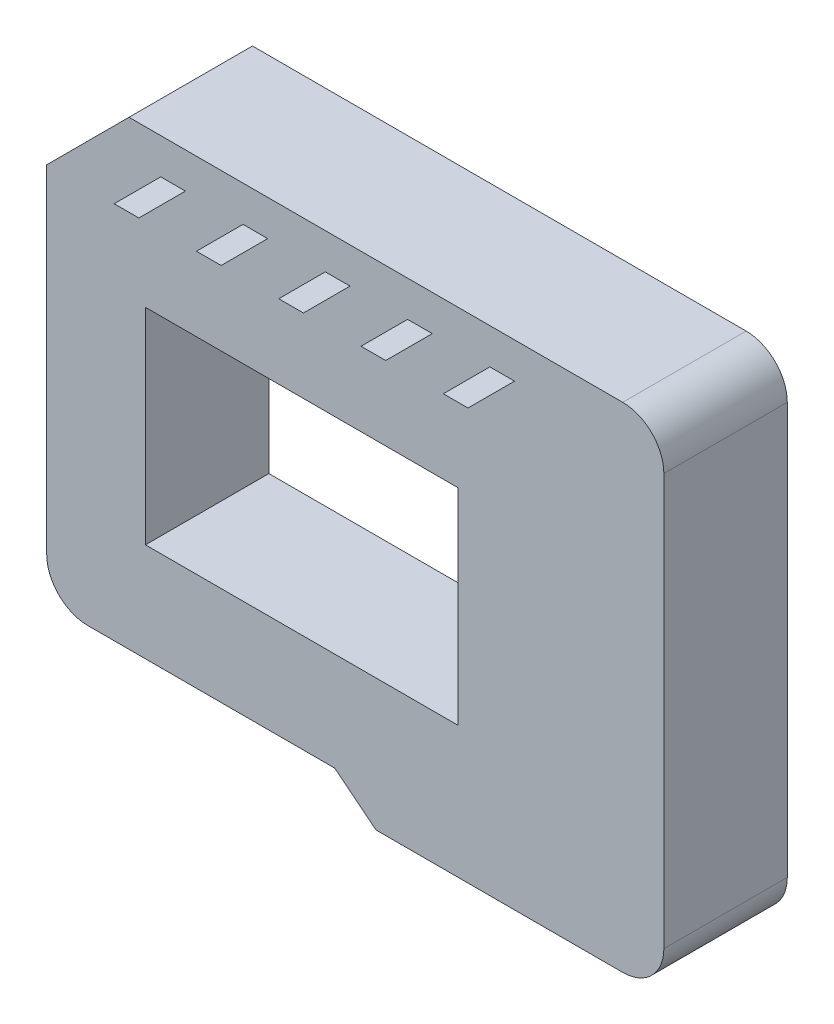
from build123d import *

# Parameters (mm, degrees)
EXTRUDE_1_DEPTH     = 15
FILLET_1_R          = 5
CUT_EXTRUDE_1_DEPTH = 90.724081338
SKETCH_4_W          = 38
SKETCH_4_H          = 25
CUT_EXTRUDE_2_DEPTH = 90.724081338


with BuildPart() as part:
    # 草图1 → 凸台-拉伸1 (new body)
    with BuildSketch(Plane.XY):
        Polygon((-9.999515105, -56.002897725), (25.000484895, -56.002897725), (30.000484895, -60.002897725), (65.000484895, -60.002897725), (65.000484895, -0.002897725), (0.000484895, -0.002897725), (-9.999515105, -10.002897725), align=None)
    extrude(amount=EXTRUDE_1_DEPTH)

    # 圆角1
    fillet_1_edges = [part.edges().sort_by_distance(p)[0] for p in [
        (-9.999515105, -56.002897725, 7.5),
        (65.000484895, -0.002897725, 7.5),
        (65.000484895, -60.002897725, 7.5),
    ]]
    fillet(fillet_1_edges, radius=FILLET_1_R)

    # 草图3 → 切除-拉伸1 (cut, through all)
    with BuildSketch(Plane.XY.offset(15)):
        Polygon((3.856343928, -4.346043475), (-1.800510321, -10.002897725), (1.199489679, -10.002897725), (6.856343928, -4.346043475), align=None)
        Polygon((16.856343928, -4.346043475), (11.199489679, -10.002897725), (8.199489679, -10.002897725), (13.856343928, -4.346043475), align=None)
        Polygon((26.856343928, -4.346043475), (21.199489679, -10.002897725), (18.199489679, -10.002897725), (23.856343928, -4.346043475), align=None)
        Polygon((36.856343928, -4.346043475), (31.199489679, -10.002897725), (28.199489679, -10.002897725), (33.856343928, -4.346043475), align=None)
        Polygon((46.856343928, -4.346043475), (41.199489679, -10.002897725), (38.199489679, -10.002897725), (43.856343928, -4.346043475), align=None)
    extrude(amount=-CUT_EXTRUDE_1_DEPTH, mode=Mode.SUBTRACT)

    # 草图4 → 切除-拉伸2 (cut, through all)
    with BuildSketch(Plane.XY.offset(15)):
        with Locations((21.000484895, -31.502897725)):
            Rectangle(SKETCH_4_W, SKETCH_4_H)
    extrude(amount=-CUT_EXTRUDE_2_DEPTH, mode=Mode.SUBTRACT)


solid = part.part
